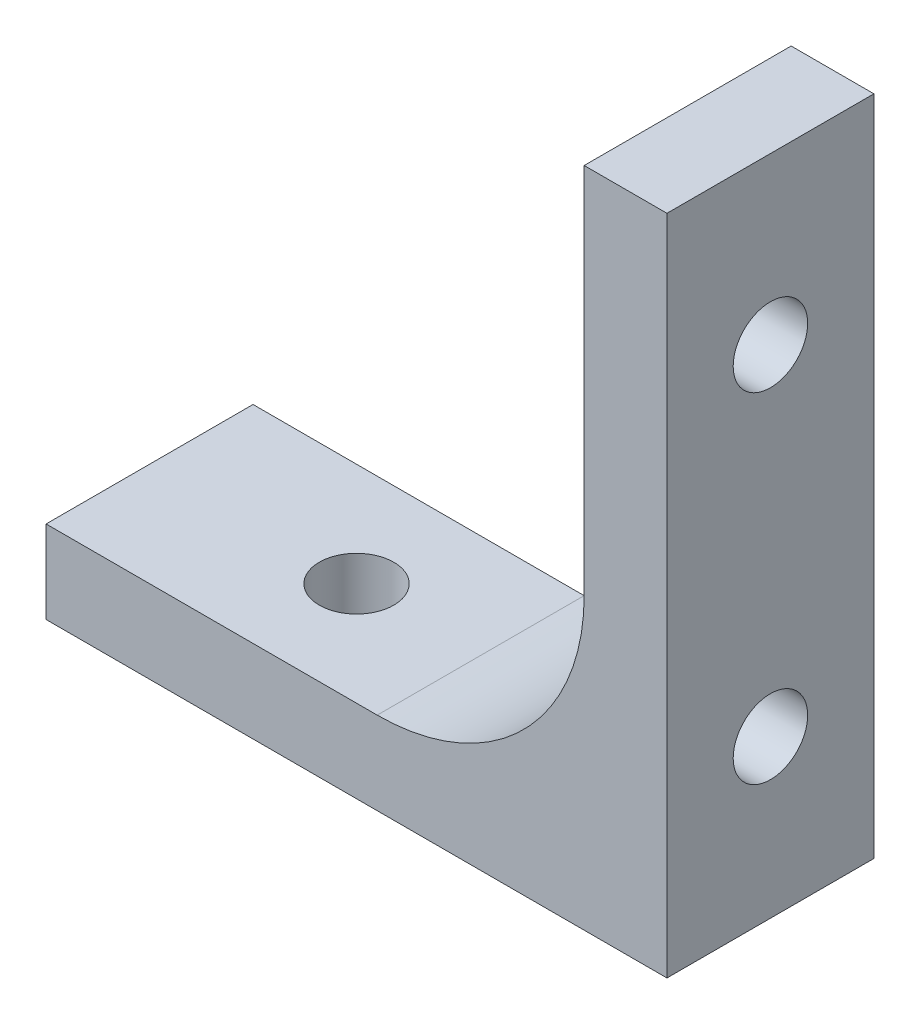
from build123d import *

# Parameters (mm, degrees)
SKETCH2_W               = 19.05
SKETCH2_H               = 6.35
BOSS_EXTRUDE1_DEPTH     = 2.54
SKETCH3_W               = 2.54
SKETCH3_H               = 6.35
BOSS_EXTRUDE2_DEPTH     = 17.78
FILLET1_R               = 6.35
SKETCH4_R               = 1.143
CUT_EXTRUDE1_DEPTH      = 27.820764344
CUT_EXTRUDE2_DEPTH      = 27.940768363
CUT_EXTRUDE2_DEPTH_BACK = 27.940768363
SKETCH5_R               = 1.143


with BuildPart() as part:
    # Sketch2 → Boss-Extrude1 (new body)
    with BuildSketch(Plane(origin=(0, 0, 0), x_dir=(1, 0, 0), z_dir=(0, 1, 0))):
        with Locations((9.525, 3.175)):
            Rectangle(SKETCH2_W, SKETCH2_H)
    extrude(amount=BOSS_EXTRUDE1_DEPTH)

    # Sketch3 → Boss-Extrude2 (add)
    with BuildSketch(Plane(origin=(0, 2.54, 0), x_dir=(1, 0, 0), z_dir=(0, 1, 0))):
        with Locations((17.78, 3.175)):
            Rectangle(SKETCH3_W, SKETCH3_H)
    extrude(amount=BOSS_EXTRUDE2_DEPTH)

    # Fillet1
    fillet1_edges = [part.edges().sort_by_distance(p)[0] for p in [
        (16.51, 2.54, -3.175),
    ]]
    fillet(fillet1_edges, radius=FILLET1_R)

    # Sketch4 → Cut-Extrude1 (cut, through all)
    with BuildSketch(Plane(origin=(0, 2.54, 0), x_dir=(1, 0, 0), z_dir=(0, 1, 0))):
        with Locations(Location((6.35, 3.175, 0), (0, 0, 270))):
            Circle(SKETCH4_R)
    extrude(amount=-CUT_EXTRUDE1_DEPTH, mode=Mode.SUBTRACT)

    # Sketch5 → Cut-Extrude2 (cut, two sides: drawn at the far end of the back side and taken through both)
    with BuildSketch(Plane.ZY.offset(-16.51).offset(-CUT_EXTRUDE2_DEPTH_BACK)):
        with Locations((-3.175, 15.24)):
            Circle(SKETCH5_R)
        with Locations((-3.175, 4.826)):
            Circle(SKETCH5_R)
    extrude(amount=CUT_EXTRUDE2_DEPTH + CUT_EXTRUDE2_DEPTH_BACK, mode=Mode.SUBTRACT)


solid = part.part
